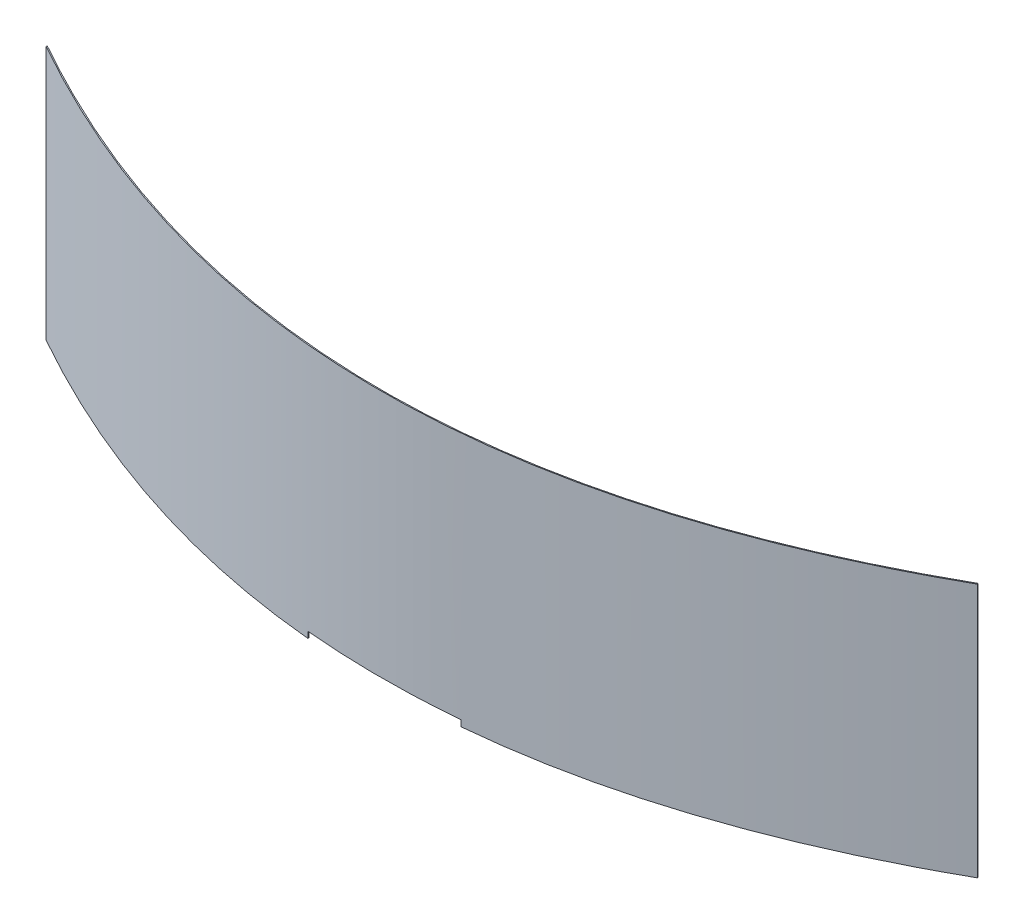
from build123d import *

# Parameters (mm, degrees)
BOSS_EXTRUDE1_DEPTH = 123
CUT_EXTRUDE1_REACH  = 327.676
SKETCH2_W           = 74
SKETCH2_H           = 3


with BuildPart() as part:
    # Sketch1 → Boss-Extrude1 (new body)
    with BuildSketch(Plane(origin=(0, 0, 0), x_dir=(1, 0, 0), z_dir=(0, 1, 0))):
        with BuildLine():
            Line((-225, -136.71875), (-225.24513062, -137.154537769))
            add(Edge.make_bspline(
                [(-225.24513062, -137.154537769), (-222.908176033, -138.469074724), (-218.204067638, -141.07390287), (-208.827276173, -146.10094494), (-197.095113634, -152.081763048), (-183.020628451, -158.761564514), (-164.252323786, -167.009400213), (-140.791197461, -176.082259845), (-112.635650998, -184.99089612), (-84.478435277, -191.920233494), (-46.93358165, -198.519950199), (0, -201.8200332), (46.93358165, -198.519950199), (84.478435277, -191.920233494), (112.635650998, -184.99089612), (140.791197461, -176.082259845), (164.252323786, -167.009400213), (183.020628451, -158.761564514), (197.095113634, -152.081763048), (208.827276173, -146.10094494), (218.204067638, -141.07390287), (222.908176033, -138.469074724), (225.24513062, -137.154537769)],
                knots=[0.496022524, 0.496022524, 0.496022524, 0.496022524, 0.49614682, 0.496271117, 0.496519709, 0.496768301, 0.497016893, 0.497514078, 0.498011262, 0.498508447, 0.499005631, 0.5, 0.500994369, 0.501491553, 0.501988738, 0.502485922, 0.502983107, 0.503231699, 0.503480291, 0.503728883, 0.50385318, 0.503977476, 0.503977476, 0.503977476, 0.503977476], degree=3))
            Line((225.24513062, -137.154537769), (225, -136.71875))
            add(Edge.make_bspline(
                [(-225, -136.71875), (0, -263.28125), (225, -136.71875)],
                knots=[0, 0, 0, 1, 1, 1], degree=2))
        make_face()
    extrude(amount=BOSS_EXTRUDE1_DEPTH)

    # Sketch2 → Cut-Extrude1 (cut, up to next)
    with BuildSketch(Plane.XY, mode=Mode.PRIVATE) as cut_extrude1_sk1:
        with Locations((0, 1.5)):
            Rectangle(SKETCH2_W, SKETCH2_H)
    cut_extrude1_tool1 = extrude(cut_extrude1_sk1.sketch, amount=CUT_EXTRUDE1_REACH, mode=Mode.PRIVATE) & part.part
    add(cut_extrude1_tool1.solids().sort_by_distance((0, 1.5, 0))[0], mode=Mode.SUBTRACT)


solid = part.part
